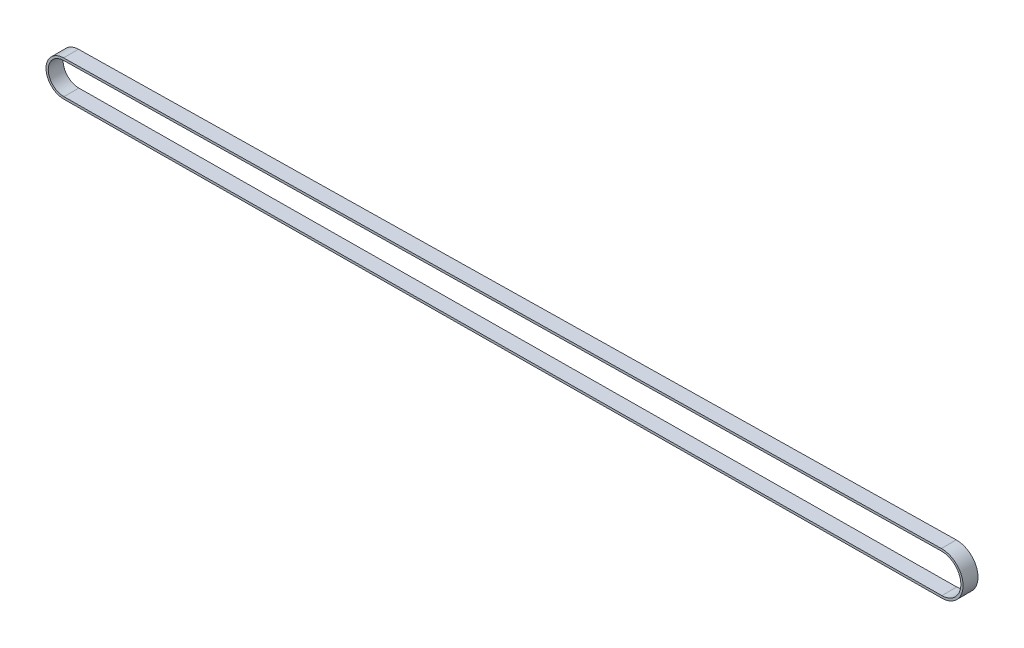
from build123d import *

# Parameters (mm, degrees)
EXTRUDE_THIN1_DEPTH = 2.5


with BuildPart() as part:
    # Sketch2 → Extrude-Thin1 (new, symmetric)
    with BuildSketch(Plane.XY):
        with BuildLine():
            Line((294.803846305, -8.504973019), (0.54449068, -10.799192787))
            ThreePointArc((0.54449068, -10.799192787), (-5.476671302, -4.895321783), (0.402597054, 1.149865398))
            Line((0.402597054, 1.149865398), (294.633455214, 5.843896016))
            ThreePointArc((294.633455214, 5.843896016), (301.922401637, -1.244994828), (294.803846305, -8.504973019))
        make_face()
        with BuildLine():
            Line((294.79799904, -7.754995813), (0.538643415, -10.049215581))
            ThreePointArc((0.538643415, -10.049215581), (-4.726724177, -4.886416251), (0.414560704, 0.399960824))
            Line((0.414560704, 0.399960824), (294.645418864, 5.093991441))
            ThreePointArc((294.645418864, 5.093991441), (301.172454511, -1.25390036), (294.79799904, -7.754995813))
        make_face(mode=Mode.SUBTRACT)
    extrude(amount=EXTRUDE_THIN1_DEPTH, both=True)


solid = part.part
